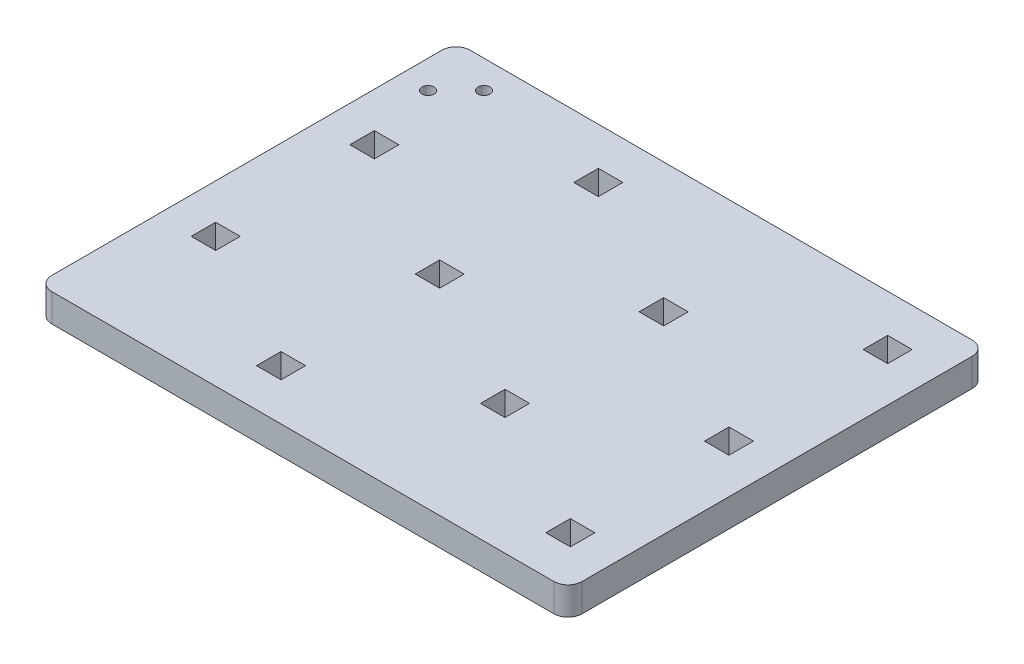
from build123d import *

# Parameters (mm, degrees)
SKETCH1_W           = 481.0125
SKETCH1_H           = 379.4125
BOSS_EXTRUDE1_DEPTH = 25.4
FILLET1_R           = 12.7
SKETCH2_W           = 22.225
SKETCH2_H           = 22.225
CUT_EXTRUDE2_DEPTH  = 25.4
SKETCH3_R           = 5.55625
CUT_EXTRUDE3_DEPTH  = 25.4


with BuildPart() as part:
    # Sketch1 → Boss-Extrude1 (new body)
    with BuildSketch(Plane(origin=(0, 0, 0), x_dir=(1, 0, 0), z_dir=(0, 1, 0))):
        with Locations((240.50625, 189.70625)):
            Rectangle(SKETCH1_W, SKETCH1_H)
    extrude(amount=BOSS_EXTRUDE1_DEPTH)

    # Fillet1
    fillet1_edges = [part.edges().sort_by_distance(p)[0] for p in [
        (0, 12.7, -379.4125),
        (481.0125, 12.7, -379.4125),
        (481.0125, 12.7, 0),
        (0, 12.7, 0),
    ]]
    fillet(fillet1_edges, radius=FILLET1_R)

    # Sketch2 → Cut-Extrude2 (cut)
    with BuildSketch(Plane(origin=(0, 25.4, 0), x_dir=(1, 0, 0), z_dir=(0, 1, 0))):
        with Locations((43.65625, 117.739583291)):
            Rectangle(SKETCH2_W, SKETCH2_H)
        with Locations((43.65625, 261.672916709)):
            Rectangle(SKETCH2_W, SKETCH2_H)
        with Locations((174.889583418, 45.772916582)):
            Rectangle(SKETCH2_W, SKETCH2_H)
        with Locations((306.122916582, 117.739583291)):
            Rectangle(SKETCH2_W, SKETCH2_H)
        with Locations((437.35625, 45.772916582)):
            Rectangle(SKETCH2_W, SKETCH2_H)
        with Locations((437.35625, 189.70625)):
            Rectangle(SKETCH2_W, SKETCH2_H)
        with Locations((437.35625, 333.639583418)):
            Rectangle(SKETCH2_W, SKETCH2_H)
        with Locations((174.889583418, 189.70625)):
            Rectangle(SKETCH2_W, SKETCH2_H)
        with Locations((174.889583418, 333.639583418)):
            Rectangle(SKETCH2_W, SKETCH2_H)
        with Locations((306.122916582, 261.672916709)):
            Rectangle(SKETCH2_W, SKETCH2_H)
    extrude(amount=-CUT_EXTRUDE2_DEPTH, mode=Mode.SUBTRACT)

    # Sketch3 → Cut-Extrude3 (cut)
    with BuildSketch(Plane(origin=(0, 25.4, 0), x_dir=(1, 0, 0), z_dir=(0, 1, 0))):
        with Locations(Location((25.4, 328.6125, 0), (0, 0, 270))):
            Circle(SKETCH3_R)
        with Locations(Location((50.8, 354.0125, 0), (0, 0, 270))):
            Circle(SKETCH3_R)
    extrude(amount=-CUT_EXTRUDE3_DEPTH, mode=Mode.SUBTRACT)


solid = part.part
